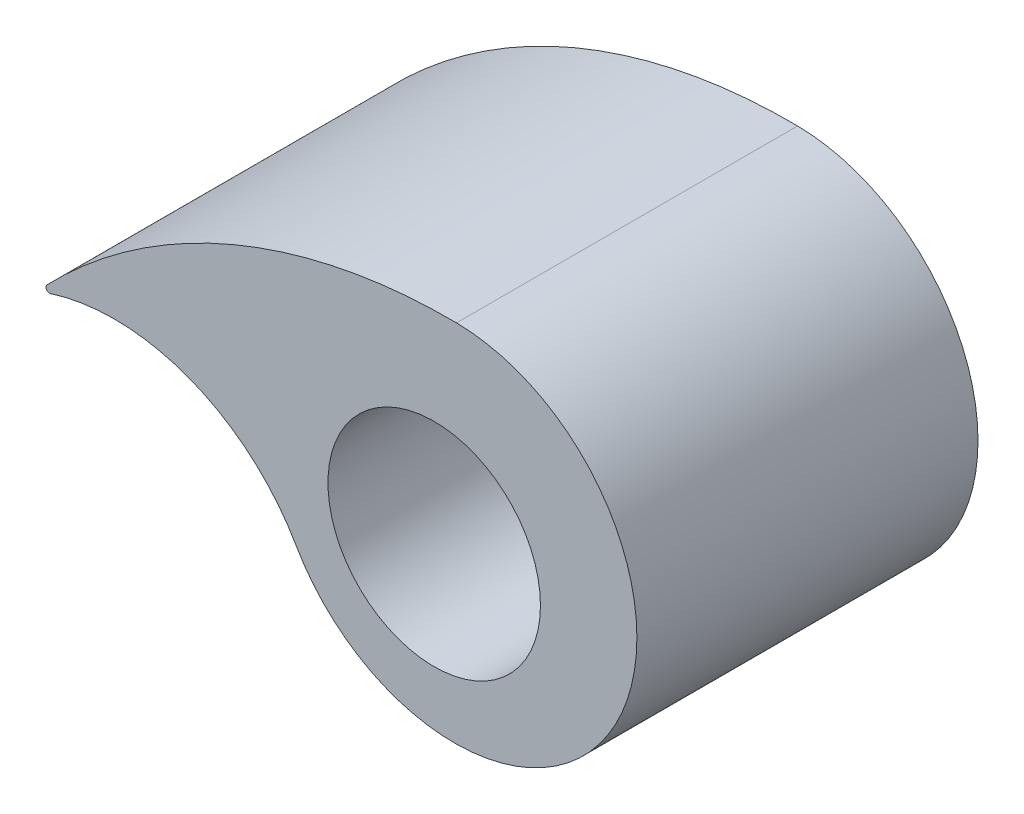
from build123d import *

# Parameters (mm, degrees)
BASE_SKETCH_R = 7.6
BASE_DEPTH    = 24.4


with BuildPart() as part:
    # Base Sketch → Base (new body)
    with BuildSketch(Plane.XY):
        with BuildLine():
            ThreePointArc((30, 13.049209956), (14.080181926, 9.934954429), (0.706182938, 0.75479397))
            ThreePointArc((0.706182938, 0.75479397), (0.674336237, 0.449442107), (0.96247377, 0.34346695))
            ThreePointArc((0.96247377, 0.34346695), (10.955807445, 0.032866395), (18.534024513, -6.488929117))
            ThreePointArc((18.534024513, -6.488929117), (41.11144962, -6.605033659), (30, 13.049209956))
        make_face()
        with Locations((28.406836056, -1.449568901)):
            Circle(BASE_SKETCH_R, mode=Mode.SUBTRACT)
    extrude(amount=-BASE_DEPTH)


solid = part.part
